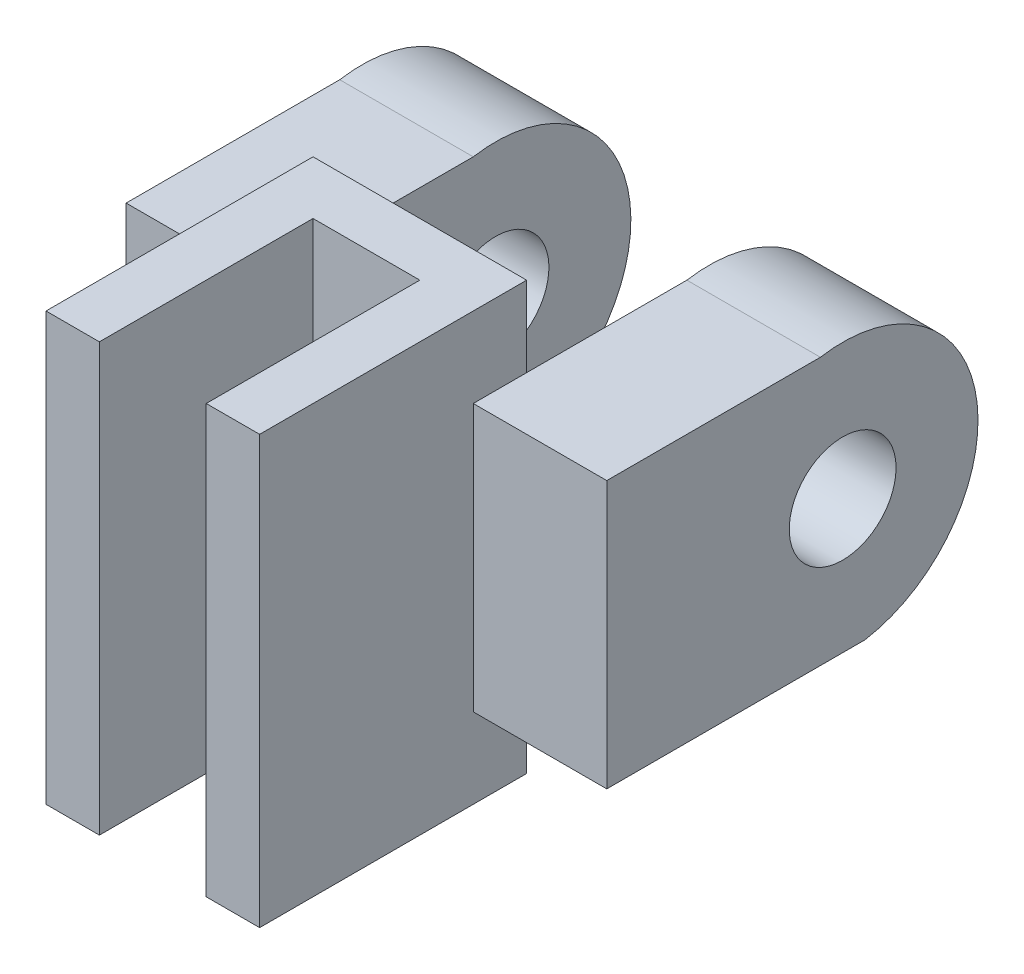
from build123d import *

# Parameters (mm, degrees)
SKETCH1_W                = 4
SKETCH1_H                = 5
BOSS_EXTRUDE1_DEPTH      = 3
SKETCH2_W                = 2
SKETCH2_H                = 5
CUT_EXTRUDE1_DEPTH       = 2
BOSS_EXTRUDE2_START      = -1
SKETCH3_R                = 1
BOSS_EXTRUDE2_DEPTH      = 3.5
SKETCH4_W                = 4
SKETCH4_H                = 5.951198117
CUT_EXTRUDE2_DEPTH       = 10.00071436
SKETCH5_W                = 9
SKETCH5_H                = 1
BOSS_EXTRUDE3_DEPTH      = 5
BOSS_EXTRUDE4_DEPTH      = 1.5
BOSS_EXTRUDE4_DEPTH_BACK = 6.5
SKETCH7_W                = 1
SKETCH7_H                = 8
BOSS_EXTRUDE5_DEPTH      = 2


with BuildPart() as part:
    # Sketch1 → Boss-Extrude1 (new body)
    with BuildSketch(Plane.XY):
        Rectangle(SKETCH1_W, SKETCH1_H)
    extrude(amount=BOSS_EXTRUDE1_DEPTH)

    # Sketch2 → Cut-Extrude1 (cut)
    with BuildSketch(Plane.XY.offset(3)):
        Rectangle(SKETCH2_W, SKETCH2_H)
    extrude(amount=-CUT_EXTRUDE1_DEPTH, mode=Mode.SUBTRACT)

    # Sketch3 → Boss-Extrude2 (add)
    with BuildSketch(Plane(origin=(2, 0, 0), x_dir=(0, 0, -1), z_dir=(1, 0, 0)).offset(BOSS_EXTRUDE2_START)):
        with BuildLine():
            Line((0, 2.5), (3, 2.5))
            ThreePointArc((3, 2.5), (5.916707084, 0.416707084), (3.833414169, -2.5))
            Line((3.833414169, -2.5), (0, -2.5))
            Line((0, -2.5), (0, 2.5))
        make_face()
        with Locations((3.416707084, 0)):
            Circle(SKETCH3_R, mode=Mode.SUBTRACT)
    boss_extrude2 = extrude(amount=BOSS_EXTRUDE2_DEPTH)

    # Mirror1: Boss-Extrude2 across plane
    add(boss_extrude2.mirror(Plane(origin=(0, 0, 0), x_dir=(0, 0, 1), z_dir=(1, 0, 0))))

    # Sketch4 → Cut-Extrude2 (cut, through all)
    with BuildSketch(Plane.XZ.offset(2.5)):
        with Locations((0, -2.975599059)):
            Rectangle(SKETCH4_W, SKETCH4_H)
    extrude(amount=-CUT_EXTRUDE2_DEPTH, mode=Mode.SUBTRACT)


with BuildPart() as cut_extrude2_piece_1:
    # of the separate pieces the step leaves, piece 1, a body of its own (cut_extrude2_pieces)
    add(part.part.solids().sort_by_distance((4.5, 2.5, 0))[0])



with BuildPart() as cut_extrude2_piece_2:
    # of the separate pieces the step leaves, piece 2, a body of its own (cut_extrude2_pieces)
    add(part.part.solids().sort_by_distance((-2, 2.5, -3))[0])


with BuildPart() as cut_extrude2_piece_3:
    # of the separate pieces the step leaves, piece 3, a body of its own (cut_extrude2_pieces)
    add(part.part.solids().sort_by_distance((-2, 2.5, 3))[0])


with BuildPart() as cut_extrude2_piece_1_1:
    add(cut_extrude2_piece_1.part)

    add(cut_extrude2_piece_2.part)  # Boss-Extrude3 merges Cut-Extrude2 piece 2

    add(cut_extrude2_piece_3.part)  # Boss-Extrude3 merges Cut-Extrude2 piece 3
    # Sketch5 → Boss-Extrude3 (add)
    with BuildSketch(Plane.XZ.offset(2.5)):
        with Locations((0, 0.5)):
            Rectangle(SKETCH5_W, SKETCH5_H)
    extrude(amount=-BOSS_EXTRUDE3_DEPTH)

    # Sketch6 → Boss-Extrude4 (add, two sides: drawn at the far end of the back side and taken through both)
    with BuildSketch(Plane(origin=(0, 2.5, 0), x_dir=(1, 0, 0), z_dir=(0, 1, 0)).offset(-BOSS_EXTRUDE4_DEPTH_BACK)):
        Polygon((-1, -3), (-1, -1), (1, -1), (1, -3), (2, -3), (2, 0), (-2, 0), (-2, -3), align=None)
    extrude(amount=BOSS_EXTRUDE4_DEPTH + BOSS_EXTRUDE4_DEPTH_BACK)

    # Sketch7 → Boss-Extrude5 (add)
    with BuildSketch(Plane.XY.offset(3)):
        with Locations((1.5, 0)):
            Rectangle(SKETCH7_W, SKETCH7_H)
        with Locations((-1.5, 0)):
            Rectangle(SKETCH7_W, SKETCH7_H)
    extrude(amount=BOSS_EXTRUDE5_DEPTH)


solid = cut_extrude2_piece_1_1.part
